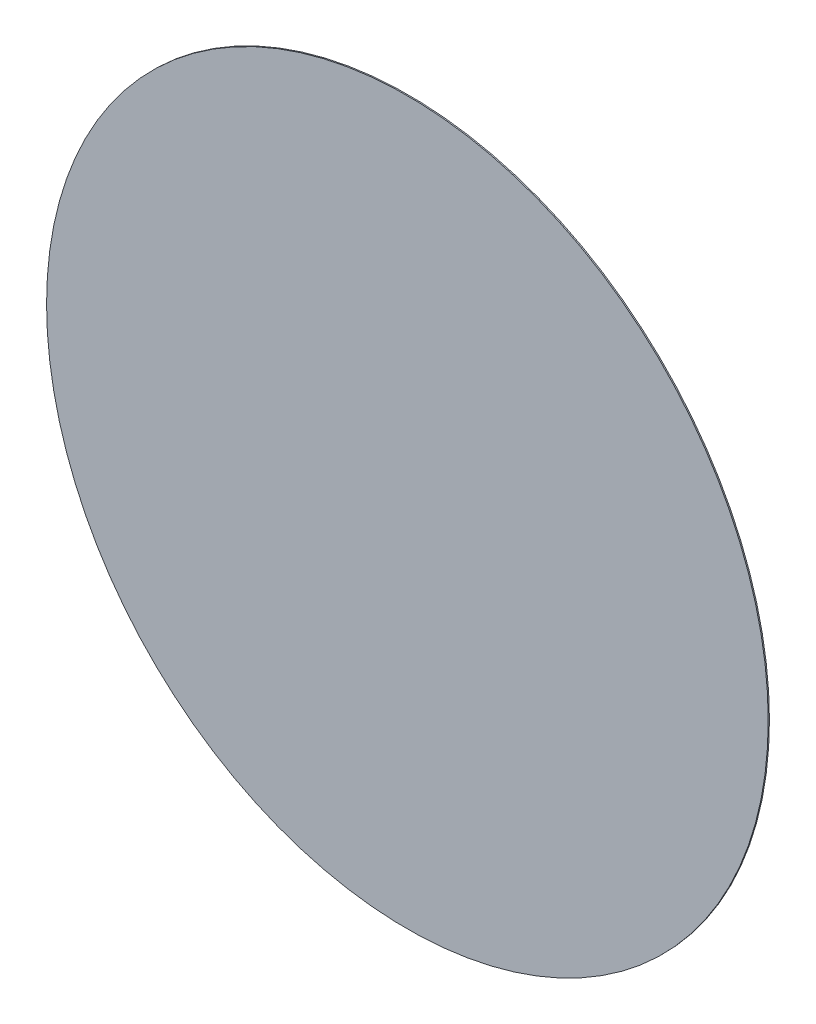
from build123d import *

# Parameters (mm, degrees)
ESQUISSE1_R        = 15
BOSS_EXTRU_1_DEPTH = 0.05


with BuildPart() as part:
    # Esquisse1 → Boss.-Extru.1 (new body)
    with BuildSketch(Plane.XY):
        Circle(ESQUISSE1_R)
    extrude(amount=BOSS_EXTRU_1_DEPTH)


solid = part.part
